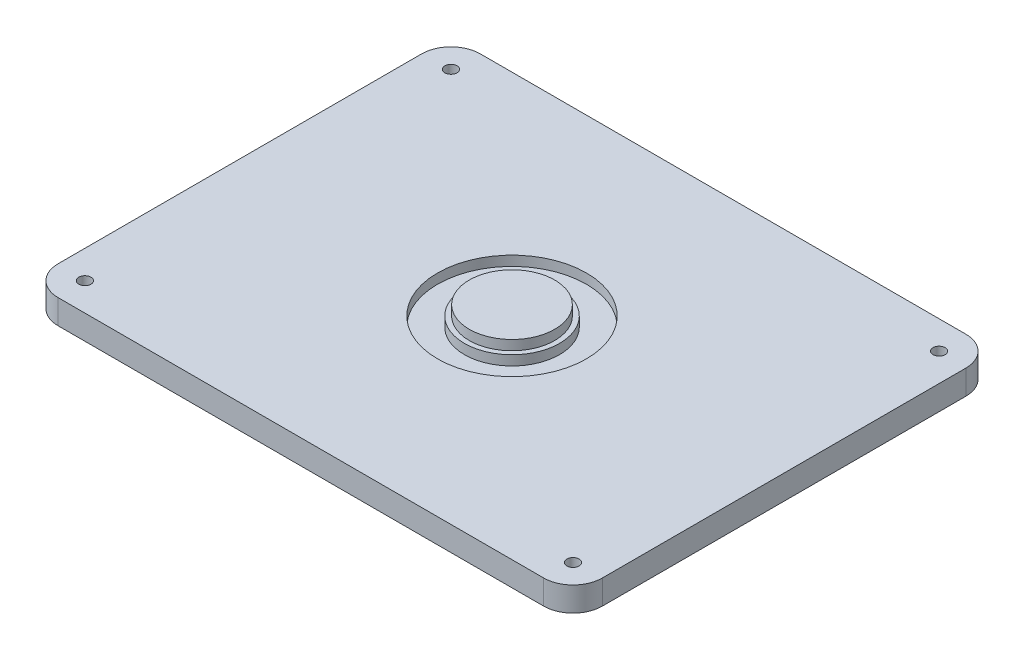
from build123d import *

# Parameters (mm, degrees)
SKETCH1_R           = 2.5
BOSS_EXTRUDE1_DEPTH = 10
SKETCH2_R           = 30.5
SKETCH2_R_2         = 19.5
CUT_EXTRUDE1_DEPTH  = 4
SKETCH3_R           = 17.5
BOSS_EXTRUDE2_DEPTH = 4


with BuildPart() as part:
    # Sketch1 → Boss-Extrude1 (new body)
    with BuildSketch(Plane(origin=(0, 0, 0), x_dir=(1, 0, 0), z_dir=(0, 1, 0))):
        with BuildLine():
            Line((-99.5, 86.5), (99.5, 86.5))
            ThreePointArc((99.5, 86.5), (107.985281374, 82.985281374), (111.5, 74.5))
            Line((111.5, 74.5), (111.5, -74.5))
            ThreePointArc((111.5, -74.5), (107.985281374, -82.985281374), (99.5, -86.5))
            Line((99.5, -86.5), (-99.5, -86.5))
            ThreePointArc((-99.5, -86.5), (-107.985281374, -82.985281374), (-111.5, -74.5))
            Line((-111.5, -74.5), (-111.5, 74.5))
            ThreePointArc((-111.5, 74.5), (-107.985281374, 82.985281374), (-99.5, 86.5))
        make_face()
        with Locations(Location((100, 75, 0), (0, 0, 270))):
            Circle(SKETCH1_R, mode=Mode.SUBTRACT)
        with Locations(Location((100, -75, 0), (0, 0, 270))):
            Circle(SKETCH1_R, mode=Mode.SUBTRACT)
        with Locations(Location((-100, -75, 0), (0, 0, 270))):
            Circle(SKETCH1_R, mode=Mode.SUBTRACT)
        with Locations(Location((-100, 75, 0), (0, 0, 270))):
            Circle(SKETCH1_R, mode=Mode.SUBTRACT)
    extrude(amount=-BOSS_EXTRUDE1_DEPTH)

    # Sketch2 → Cut-Extrude1 (cut)
    with BuildSketch(Plane(origin=(0, 0, 0), x_dir=(1, 0, 0), z_dir=(0, 1, 0))):
        with Locations(Location((0, 0, 0), (0, 0, 270))):
            Circle(SKETCH2_R)
        with Locations(Location((0, 0, 0), (0, 0, 270))):
            Circle(SKETCH2_R_2, mode=Mode.SUBTRACT)
    extrude(amount=-CUT_EXTRUDE1_DEPTH, mode=Mode.SUBTRACT)

    # Sketch3 → Boss-Extrude2 (add)
    with BuildSketch(Plane(origin=(0, 0, 0), x_dir=(1, 0, 0), z_dir=(0, 1, 0))):
        with Locations(Location((0, 0, 0), (0, 0, 270))):
            Circle(SKETCH3_R)
    extrude(amount=BOSS_EXTRUDE2_DEPTH)


solid = part.part
